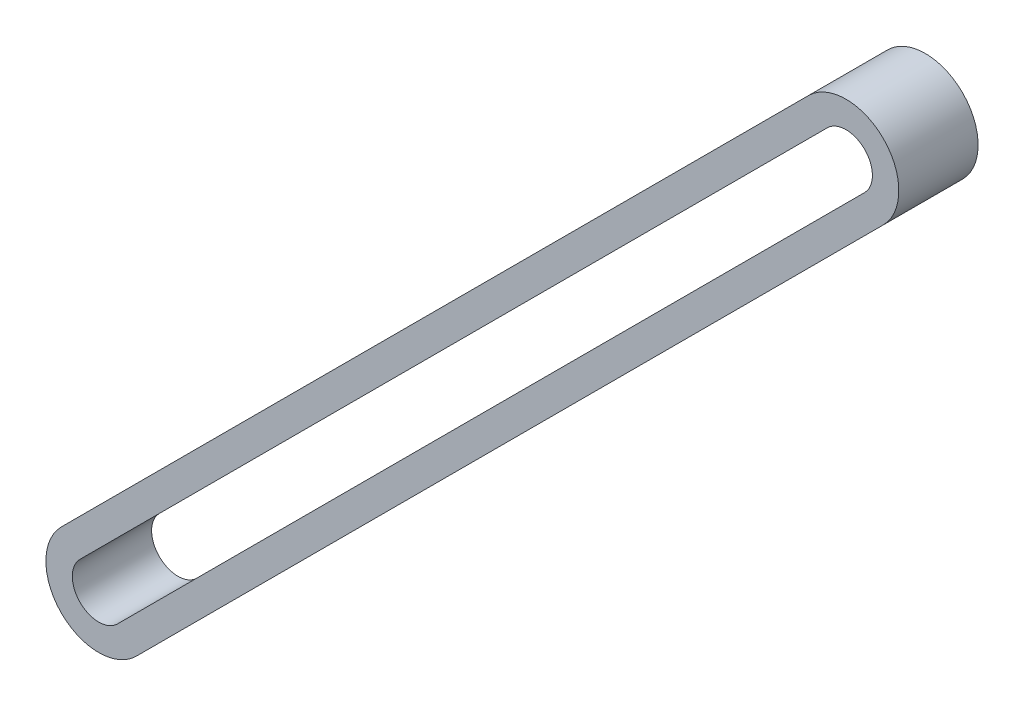
from build123d import *

# Parameters (mm, degrees)
BOSS_EXTRUDE1_DEPTH = 3


with BuildPart() as part:
    # Sketch1 → Boss-Extrude1 (new body)
    with BuildSketch(Plane.XY):
        with BuildLine():
            Line((-1.414213562, 1.414213562), (26.870057685, 29.69848481))
            ThreePointArc((26.870057685, 29.69848481), (29.69848481, 29.69848481), (29.69848481, 26.870057685))
            Line((29.69848481, 26.870057685), (1.414213562, -1.414213562))
            ThreePointArc((1.414213562, -1.414213562), (-1.414213562, -1.414213562), (-1.414213562, 1.414213562))
        make_face()
        with BuildLine():
            Line((-0.707106781, 0.707106781), (27.577164466, 28.991378029))
            ThreePointArc((27.577164466, 28.991378029), (28.991378029, 28.991378029), (28.991378029, 27.577164466))
            Line((28.991378029, 27.577164466), (0.707106781, -0.707106781))
            ThreePointArc((0.707106781, -0.707106781), (-0.707106781, -0.707106781), (-0.707106781, 0.707106781))
        make_face(mode=Mode.SUBTRACT)
    extrude(amount=BOSS_EXTRUDE1_DEPTH)


solid = part.part
